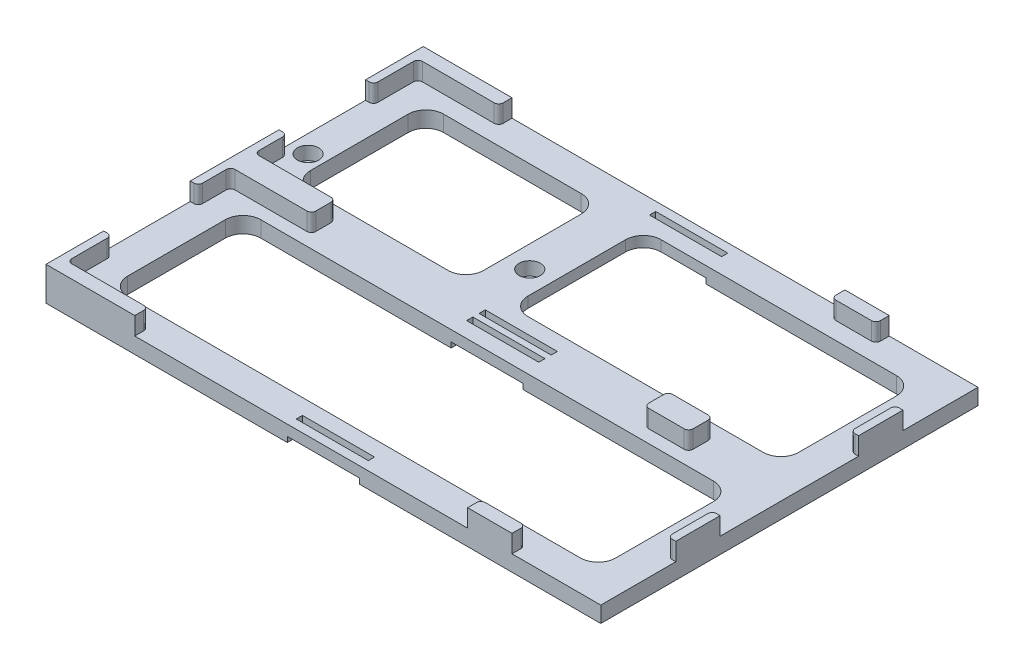
from build123d import *

# Parameters (mm, degrees)
SKETCH3_W                          = 158.75
SKETCH3_H                          = 107.95
BASE_EXTRUDE_DEPTH                 = 4.572
SKETCH4_W                          = 20.6375
SKETCH4_H                          = 1.778
SKETCH4_W_2                        = 139.7
SKETCH4_H_2                        = 38.1
VELCRO_SLITS_DEPTH                 = 193.030383492
SKETCH6_W                          = 2.286
SKETCH6_H                          = 12.7
SKETCH6_W_2                        = 12.7
SKETCH6_H_2                        = 3.81
SKETCH6_H_3                        = 6.858
POSITION_GUIDES_DEPTH              = 5.08
FILLET1_R                          = 1.27
SKETCH7_R                          = 1.905
SKETCH7_W                          = 12.7
SKETCH7_H                          = 38.1
RIGHT_SCREW_HOLE_AND_SUPPORT_DEPTH = 4.572
SKETCH10_R                         = 1.905
LEFT_SCREW_HOLE_DEPTH              = 193.043149839
FILLET2_R                          = 5.08
SKETCH11_R                         = 3.048
SCREWHEAD_CUTOUTS_DEPTH            = 3.81
SKETCH5_W                          = 20.6375
SKETCH5_H                          = 1.524
CUT_EXTRUDE1_DEPTH                 = 193.21843331


with BuildPart() as part:
    # Sketch3 → Base Extrude (new body)
    with BuildSketch(Plane(origin=(0, 0, 0), x_dir=(1, 0, 0), z_dir=(0, 1, 0))):
        with Locations((79.375, 53.975)):
            Rectangle(SKETCH3_W, SKETCH3_H)
    extrude(amount=BASE_EXTRUDE_DEPTH)

    # Sketch4 → Velcro slits (cut, through all)
    with BuildSketch(Plane(origin=(0, 4.572, 0), x_dir=(1, 0, 0), z_dir=(0, 1, 0))):
        with Locations((79.375, 104.521)):
            Rectangle(SKETCH4_W, SKETCH4_H)
        with Locations((79.375, 55.753)):
            Rectangle(SKETCH4_W, SKETCH4_H)
        with Locations((79.375, 52.197)):
            Rectangle(SKETCH4_W, SKETCH4_H)
        with Locations((79.375, 3.429)):
            Rectangle(SKETCH4_W, SKETCH4_H)
        with Locations((79.375, 27.813)):
            Rectangle(SKETCH4_W_2, SKETCH4_H_2)
        with Locations((79.375, 80.137)):
            Rectangle(SKETCH4_W_2, SKETCH4_H_2)
    extrude(amount=-VELCRO_SLITS_DEPTH, mode=Mode.SUBTRACT)

    # Sketch6 → Position Guides (add)
    with BuildSketch(Plane(origin=(0, 4.572, 0), x_dir=(1, 0, 0), z_dir=(0, 1, 0))):
        Polygon((2.286, 16.51), (2.286, 3.81), (25.4, 3.81), (25.4, 0), (0, 0), (0, 16.51), align=None)
        Polygon((2.286, 41.275), (2.286, 50.546), (25.4, 50.546), (25.4, 57.404), (2.286, 57.404), (2.286, 66.675), (0, 66.675), (0, 41.275), align=None)
        Polygon((0, 91.44), (2.286, 91.44), (2.286, 104.14), (25.4, 104.14), (25.4, 107.95), (0, 107.95), align=None)
        with Locations((157.607, 80.137)):
            Rectangle(SKETCH6_W, SKETCH6_H)
        with Locations((157.607, 27.813)):
            Rectangle(SKETCH6_W, SKETCH6_H)
        with Locations((127, 106.045)):
            Rectangle(SKETCH6_W_2, SKETCH6_H_2)
        with Locations((127, 53.975)):
            Rectangle(SKETCH6_W_2, SKETCH6_H_3)
        with Locations((127, 1.905)):
            Rectangle(SKETCH6_W_2, SKETCH6_H_2)
    extrude(amount=POSITION_GUIDES_DEPTH)

    # Fillet1
    fillet1_edges = [part.edges().sort_by_distance(p)[0] for p in [
        (2.286, 7.112, -16.51),
        (25.4, 7.112, -3.81),
        (2.286, 7.112, -3.81),
        (2.286, 7.112, -41.275),
        (2.286, 7.112, -50.546),
        (25.4, 7.112, -50.546),
        (25.4, 7.112, -57.404),
        (2.286, 7.112, -57.404),
        (2.286, 7.112, -66.675),
        (2.286, 7.112, -91.44),
        (2.286, 7.112, -104.14),
        (25.4, 7.112, -104.14),
        (156.464, 7.112, -86.487),
        (156.464, 7.112, -73.787),
        (156.464, 7.112, -34.163),
        (156.464, 7.112, -21.463),
        (120.65, 7.112, -57.404),
        (120.65, 7.112, -50.546),
        (133.35, 7.112, -50.546),
        (133.35, 7.112, -57.404),
        (133.35, 7.112, -104.14),
        (120.65, 7.112, -104.14),
        (133.35, 7.112, -3.81),
        (120.65, 7.112, -3.81),
    ]]
    fillet(fillet1_edges, radius=FILLET1_R)

    # Sketch7 → Right screw hole and support (add)
    # profile 1 of 2: a face of its own
    with BuildSketch(Plane(origin=(0, 4.572, 0), x_dir=(1, 0, 0), z_dir=(0, 1, 0))):
        with Locations((5.08, 69.85)):
            Circle(SKETCH7_R)
    # profile 2 of 2: a face of its own
    with BuildSketch(Plane(origin=(0, 4.572, 0), x_dir=(1, 0, 0), z_dir=(0, 1, 0))):
        with Locations((65.405, 80.137)):
            Rectangle(SKETCH7_W, SKETCH7_H)
        with Locations(Location((65.405, 73.025, 0), (0, 0, 270))):
            Circle(SKETCH7_R, mode=Mode.SUBTRACT)
    extrude(amount=-RIGHT_SCREW_HOLE_AND_SUPPORT_DEPTH)

    # Sketch10 → Left Screw Hole (cut, through all)
    with BuildSketch(Plane(origin=(0, 4.572, 0), x_dir=(1, 0, 0), z_dir=(0, 1, 0))):
        with Locations(Location((5.08, 69.9135, 0), (0, 0, 270))):
            Circle(SKETCH10_R)
    extrude(amount=-LEFT_SCREW_HOLE_DEPTH, mode=Mode.SUBTRACT)

    # Fillet2
    fillet2_edges = [part.edges().sort_by_distance(p)[0] for p in [
        (59.055, 2.286, -99.187),
        (71.755, 2.286, -99.187),
        (71.755, 2.286, -61.087),
        (59.055, 2.286, -61.087),
        (9.525, 2.286, -8.763),
        (9.525, 2.286, -46.863),
        (149.225, 2.286, -46.863),
        (149.225, 2.286, -8.763),
        (9.525, 2.286, -61.087),
        (9.525, 2.286, -99.187),
        (149.225, 2.286, -99.187),
        (149.225, 2.286, -61.087),
    ]]
    fillet(fillet2_edges, radius=FILLET2_R)

    # Sketch11 → Screwhead cutouts (cut)
    with BuildSketch(Plane(origin=(0, 4.572, 0), x_dir=(1, 0, 0), z_dir=(0, 1, 0))):
        with Locations(Location((5.08, 69.9135, 0), (0, 0, 270))):
            Circle(SKETCH11_R)
        with Locations(Location((65.405, 73.025, 0), (0, 0, 270))):
            Circle(SKETCH11_R)
    extrude(amount=-SCREWHEAD_CUTOUTS_DEPTH, mode=Mode.SUBTRACT)

    # Sketch5 → Cut-Extrude1 (cut, through all)
    with BuildSketch(Plane.XY):
        with Locations((79.375, 0.762)):
            Rectangle(SKETCH5_W, SKETCH5_H)
    extrude(amount=-CUT_EXTRUDE1_DEPTH, mode=Mode.SUBTRACT)


solid = part.part
